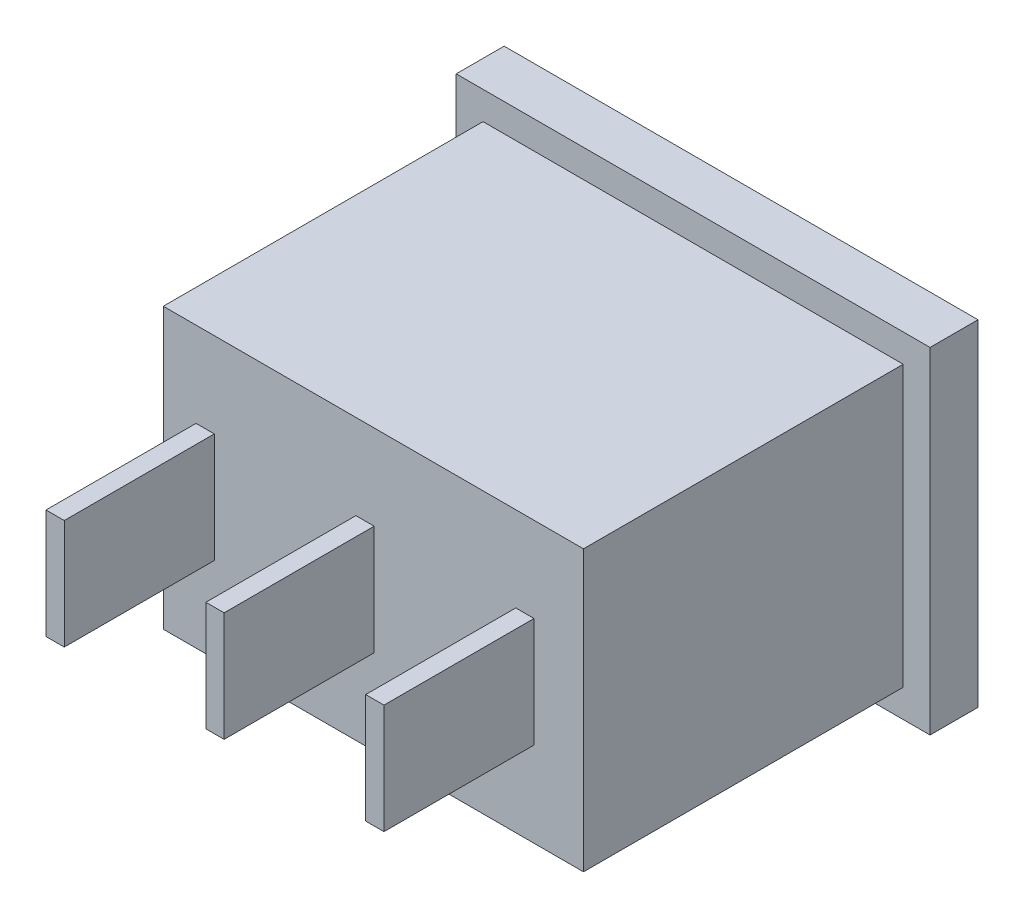
from build123d import *

# Parameters (mm, degrees)
ESQUISSE1_W             = 20.75
ESQUISSE1_H             = 14.7
BOSS_EXTRU_1_DEPTH      = 2.1
ESQUISSE2_W             = 18.4
ESQUISSE2_H             = 12.25
BOSS_EXTRU_2_DEPTH      = 14
ESQUISSE3_W             = 0.8
ESQUISSE3_H             = 4.8
BOSS_EXTRU_3_DEPTH      = 6.57
ESQUISSE4_W             = 14.99
ESQUISSE4_H             = 9.5
BOSS_EXTRU_4_DEPTH      = 2
ENL_V_MAT_EXTRU_1_REACH = 29.712


with BuildPart() as part:
    # Esquisse1 → Boss.-Extru.1 (new body)
    with BuildSketch(Plane.XY):
        Rectangle(ESQUISSE1_W, ESQUISSE1_H)
    extrude(amount=BOSS_EXTRU_1_DEPTH)

    # Esquisse2 → Boss.-Extru.2 (add)
    with BuildSketch(Plane.XY.offset(2.1)):
        Rectangle(ESQUISSE2_W, ESQUISSE2_H)
    extrude(amount=BOSS_EXTRU_2_DEPTH)

    # Esquisse3 → Boss.-Extru.3 (add)
    with BuildSketch(Plane.XY.offset(16.1)):
        with Locations((-0.366571113, 0)):
            Rectangle(ESQUISSE3_W, ESQUISSE3_H)
        with Locations((6.633428887, 0)):
            Rectangle(ESQUISSE3_W, ESQUISSE3_H)
        with Locations((-7.366571113, 0)):
            Rectangle(ESQUISSE3_W, ESQUISSE3_H)
    extrude(amount=BOSS_EXTRU_3_DEPTH)

    # Esquisse4 → Boss.-Extru.4 (add)
    with BuildSketch(Plane(origin=(0, 0, 0), x_dir=(-1, 0, 0), z_dir=(0, 0, -1))):
        Rectangle(ESQUISSE4_W, ESQUISSE4_H)
    extrude(amount=BOSS_EXTRU_4_DEPTH)

    # Esquisse5 → Enlèv. mat.-Extru.1 (cut, up to next)
    with BuildSketch(Plane(origin=(0, 4.75, 0), x_dir=(1, 0, 0), z_dir=(0, 1, 0)), mode=Mode.PRIVATE) as enl_v_mat_extru_1_sk1:
        with BuildLine():
            Line((-7.495, 2), (7.495, 2))
            ThreePointArc((7.495, 2), (0, 0.856909001), (-7.495, 2))
        make_face()
    enl_v_mat_extru_1_tool1 = extrude(enl_v_mat_extru_1_sk1.sketch, amount=-ENL_V_MAT_EXTRU_1_REACH, mode=Mode.PRIVATE) & part.part
    add(enl_v_mat_extru_1_tool1.solids().sort_by_distance((0, 4.75, -1.541861))[0], mode=Mode.SUBTRACT)


solid = part.part
